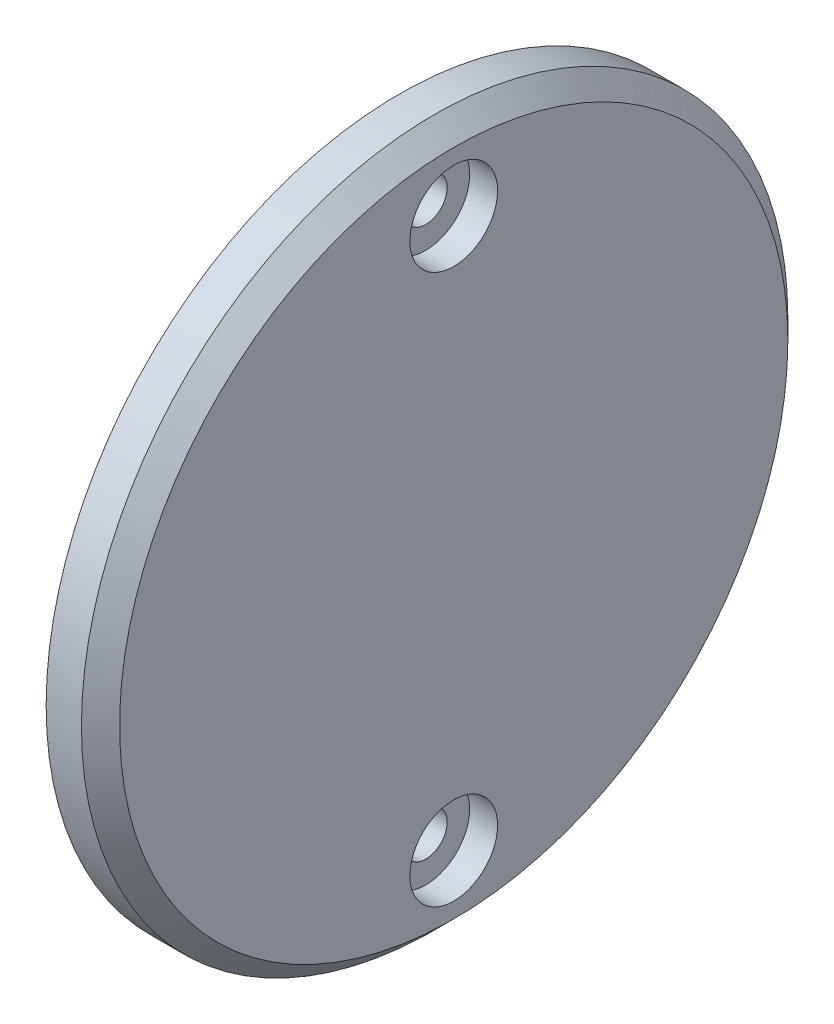
from build123d import *

# Parameters (mm, degrees)
SKETCH1_R           = 55.5625
BOSS_EXTRUDE1_DEPTH = 8.55
CHAMFER1_SIZE       = 3
SKETCH3_R           = 6.9
CUT_EXTRUDE1_DEPTH  = 4.4
SKETCH4_R           = 3.375
CUT_EXTRUDE2_DEPTH  = 4.15


with BuildPart() as part:
    # Sketch1 → Boss-Extrude1 (new body)
    with BuildSketch(Plane(origin=(0, 0, 0), x_dir=(0, 0, -1), z_dir=(1, 0, 0))):
        Circle(SKETCH1_R)
    extrude(amount=BOSS_EXTRUDE1_DEPTH)

    # Chamfer1
    chamfer1_edges = [part.edges().sort_by_distance(p)[0] for p in [
        (8.55, 0, 55.5625),
    ]]
    chamfer(chamfer1_edges, length=CHAMFER1_SIZE)

    # Sketch3 → Cut-Extrude1 (cut)
    with BuildSketch(Plane(origin=(8.55, 0, 0), x_dir=(0, 0, -1), z_dir=(1, 0, 0))):
        with Locations((0, 43.225)):
            Circle(SKETCH3_R)
        with Locations((0, -43.225)):
            Circle(SKETCH3_R)
    extrude(amount=-CUT_EXTRUDE1_DEPTH, mode=Mode.SUBTRACT)

    # Sketch4 → Cut-Extrude2 (cut)
    with BuildSketch(Plane(origin=(4.15, 0, 0), x_dir=(0, 0, -1), z_dir=(1, 0, 0))):
        with Locations((0, 43.225)):
            Circle(SKETCH4_R)
        with Locations((0, -43.225)):
            Circle(SKETCH4_R)
    extrude(amount=-CUT_EXTRUDE2_DEPTH, mode=Mode.SUBTRACT)


solid = part.part
